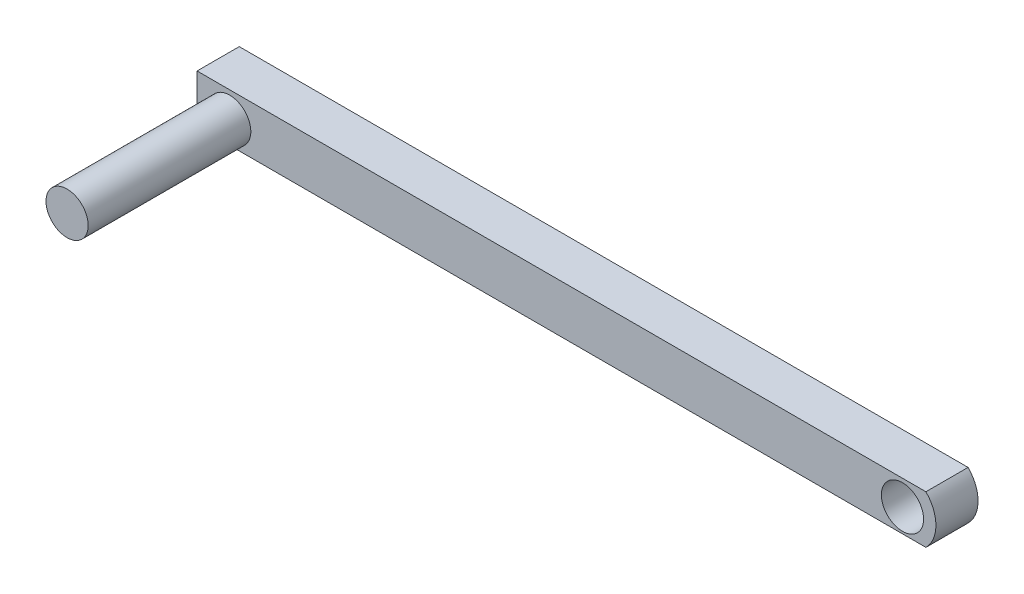
from build123d import *

# Parameters (mm, degrees)
SKETCH1_W           = 250
SKETCH1_H           = 16
BOSS_EXTRUDE1_DEPTH = 14
SKETCH2_R           = 7
CUT_EXTRUDE1_DEPTH  = 148.715171273
CUT_EXTRUDE3_DEPTH  = 148.715171273
SKETCH4_R           = 7
BOSS_EXTRUDE2_DEPTH = 14
SKETCH5_R           = 7
BOSS_EXTRUDE3_DEPTH = 40


with BuildPart() as part:
    # Sketch1 → Boss-Extrude1 (new body)
    with BuildSketch(Plane.XY):
        with Locations((17.628205128, 27.790598291)):
            Rectangle(SKETCH1_W, SKETCH1_H)
    extrude(amount=BOSS_EXTRUDE1_DEPTH)

    # Sketch2 → Cut-Extrude1 (cut, through all)
    with BuildSketch(Plane.XY.offset(14)):
        with Locations((126.832264356, 27.518873536)):
            Circle(SKETCH2_R)
    extrude(amount=-CUT_EXTRUDE1_DEPTH, mode=Mode.SUBTRACT)

    # Sketch3 → Cut-Extrude3 (cut, through all)
    with BuildSketch(Plane.XY.offset(14)):
        with BuildLine():
            Line((142.628205128, 19.790598291), (134.612843431, 19.790598291))
            ThreePointArc((134.612843431, 19.790598291), (137.92655193, 27.790598291), (134.612843431, 35.790598291))
            Line((134.612843431, 35.790598291), (142.628205128, 35.790598291))
            Line((142.628205128, 35.790598291), (142.628205128, 19.790598291))
        make_face()
    extrude(amount=-CUT_EXTRUDE3_DEPTH, mode=Mode.SUBTRACT)

    # Sketch4 → Boss-Extrude2 (add)
    with BuildSketch(Plane.XY.offset(14)):
        with Locations(Location((-96.531660716, 27.264616337, 0), (0, 0, 180))):
            Circle(SKETCH4_R)
    extrude(amount=BOSS_EXTRUDE2_DEPTH)

    # Sketch5 → Boss-Extrude3 (add)
    with BuildSketch(Plane.XY.offset(28)):
        with Locations(Location((-96.531660716, 27.264616337, 0), (0, 0, 180))):
            Circle(SKETCH5_R)
    extrude(amount=BOSS_EXTRUDE3_DEPTH)


solid = part.part
